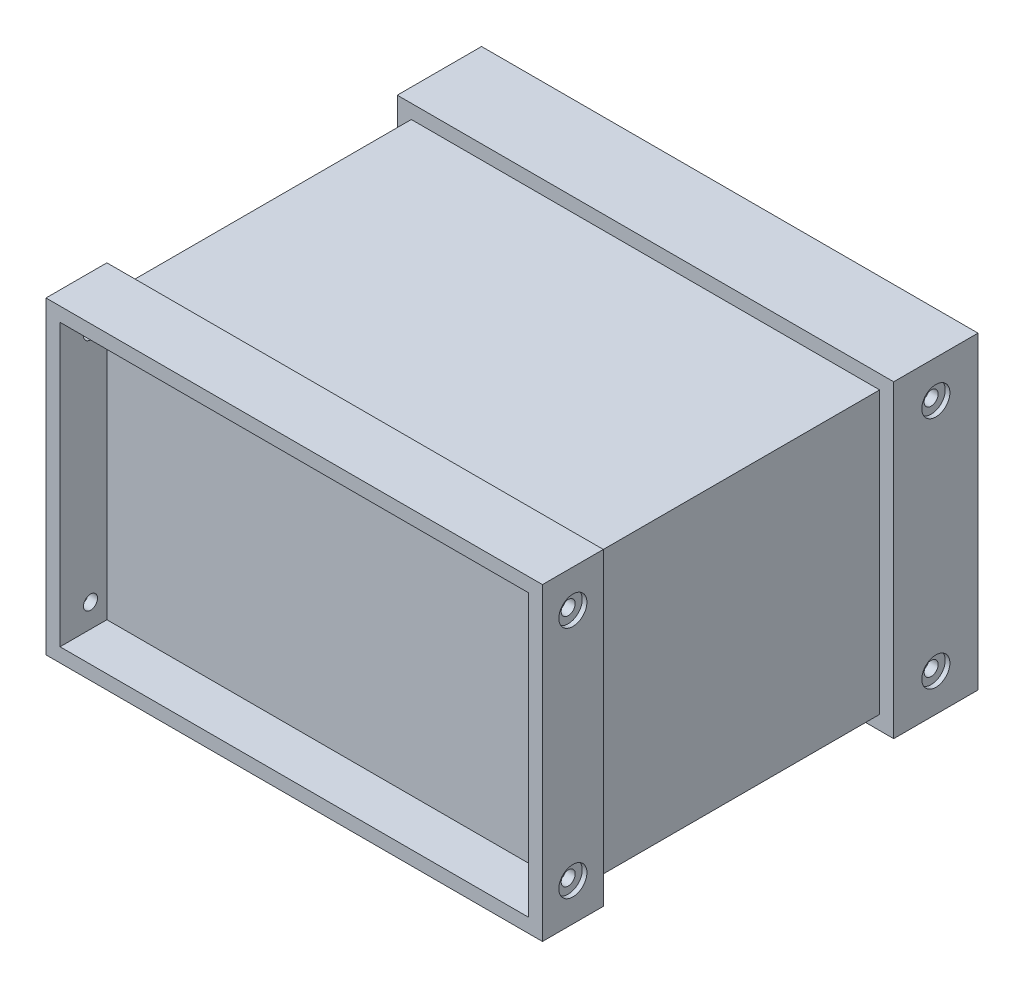
from build123d import *

# Parameters (mm, degrees)
SKETCH1_W                = 100
SKETCH1_H                = 60
BOSS_EXTRUDE1_DEPTH      = 150
SKETCH2_W                = 95
SKETCH2_H                = 15
CUT_EXTRUDE1_DEPTH       = 20
BOSS_EXTRUDE2_DEPTH      = 13
BOSS_EXTRUDE2_DEPTH_BACK = 5
SKETCH3_W                = 106
SKETCH3_H                = 66
SKETCH3_W_2              = 100
SKETCH3_H_2              = 60
SKETCH4_R                = 1.5
CUT_EXTRUDE2_DEPTH       = 120
SKETCH5_R                = 3
CUT_EXTRUDE3_DEPTH       = 1
CUT_EXTRUDE4_START       = -1
SKETCH6_R                = 3
CUT_EXTRUDE4_DEPTH       = 1
SKETCH8_W                = 125.879436885
SKETCH8_H                = 80.445742456
CUT_EXTRUDE6_DEPTH       = 80
BOSS_EXTRUDE3_DEPTH      = 10
BOSS_EXTRUDE3_DEPTH_BACK = 3
SKETCH9_W                = 106
SKETCH9_H                = 66
SKETCH9_W_2              = 100
SKETCH9_H_2              = 60
SKETCH10_R               = 1.5
CUT_EXTRUDE7_DEPTH       = 117
SKETCH10_3_R             = 3
CUT_EXTRUDE8_DEPTH       = 1
CUT_EXTRUDE9_START       = -1
SKETCH11_R               = 3
CUT_EXTRUDE9_DEPTH       = 1
SKETCH12_W               = 100
SKETCH12_H               = 60
BOSS_EXTRUDE4_DEPTH      = 2
SKETCH13_W               = 80
SKETCH13_H               = 42
CUT_EXTRUDE10_DEPTH      = 10


with BuildPart() as part:
    # Sketch1 → Boss-Extrude1 (new body)
    with BuildSketch(Plane.XY):
        with Locations((9.751655629, 0.960264901)):
            Rectangle(SKETCH1_W, SKETCH1_H)
        with BuildLine():
            Line((-37.748344371, 21.277806535), (-37.748344371, 28.460264901))
            Line((-37.748344371, 28.460264901), (-30.565886005, 28.460264901))
            ThreePointArc((-30.565886005, 28.460264901), (-33.177276559, 23.889197089), (-37.748344371, 21.277806535))
        make_face(mode=Mode.SUBTRACT)
        with BuildLine():
            Line((-37.748344371, -17.303040505), (-37.748344371, 19.223570306))
            ThreePointArc((-37.748344371, 19.223570306), (-31.763062997, 22.474983526), (-28.511649777, 28.460264901))
            Line((-28.511649777, 28.460264901), (48.014961035, 28.460264901))
            ThreePointArc((48.014961035, 28.460264901), (51.266374255, 22.474983526), (57.251655629, 19.223570306))
            Line((57.251655629, 19.223570306), (57.251655629, -17.303040505))
            ThreePointArc((57.251655629, -17.303040505), (51.266374255, -20.554453725), (48.014961035, -26.539735099))
            Line((48.014961035, -26.539735099), (-28.511649777, -26.539735099))
            ThreePointArc((-28.511649777, -26.539735099), (-31.763062997, -20.554453725), (-37.748344371, -17.303040505))
        make_face(mode=Mode.SUBTRACT)
        with BuildLine():
            Line((-37.748344371, -26.539735099), (-37.748344371, -19.357276734))
            ThreePointArc((-37.748344371, -19.357276734), (-33.177276559, -21.968667287), (-30.565886005, -26.539735099))
            Line((-30.565886005, -26.539735099), (-37.748344371, -26.539735099))
        make_face(mode=Mode.SUBTRACT)
        with BuildLine():
            Line((57.251655629, -26.539735099), (50.069197264, -26.539735099))
            ThreePointArc((50.069197264, -26.539735099), (52.680587817, -21.968667287), (57.251655629, -19.357276734))
            Line((57.251655629, -19.357276734), (57.251655629, -26.539735099))
        make_face(mode=Mode.SUBTRACT)
        with BuildLine():
            Line((57.251655629, 28.460264901), (57.251655629, 21.277806535))
            ThreePointArc((57.251655629, 21.277806535), (52.680587817, 23.889197089), (50.069197264, 28.460264901))
            Line((50.069197264, 28.460264901), (57.251655629, 28.460264901))
        make_face(mode=Mode.SUBTRACT)
    extrude(amount=BOSS_EXTRUDE1_DEPTH)

    # Sketch2 → Cut-Extrude1 (cut)
    with BuildSketch(Plane(origin=(0, 30.960264901, 0), x_dir=(1, 0, 0), z_dir=(0, 1, 0))):
        with Locations((9.751655629, -142.5)):
            Rectangle(SKETCH2_W, SKETCH2_H)
    extrude(amount=-CUT_EXTRUDE1_DEPTH, mode=Mode.SUBTRACT)

    # Sketch3 → Boss-Extrude2 (add, two sides: drawn at the far end of the back side and taken through both)
    with BuildSketch(Plane(origin=(0, 0, 0), x_dir=(-1, 0, 0), z_dir=(0, 0, -1)).offset(-BOSS_EXTRUDE2_DEPTH_BACK)):
        with Locations((-9.751655629, 0.960264901)):
            Rectangle(SKETCH3_W, SKETCH3_H)
        with Locations((-9.751655629, 0.960264901)):
            Rectangle(SKETCH3_W_2, SKETCH3_H_2, mode=Mode.SUBTRACT)
    extrude(amount=BOSS_EXTRUDE2_DEPTH + BOSS_EXTRUDE2_DEPTH_BACK)

    # Sketch4 → Cut-Extrude2 (cut)
    with BuildSketch(Plane.ZY.offset(43.248344371)):
        with Locations((-4, -24.039735099)):
            Circle(SKETCH4_R)
        with Locations((-4, 25.960264901)):
            Circle(SKETCH4_R)
    extrude(amount=-CUT_EXTRUDE2_DEPTH, mode=Mode.SUBTRACT)

    # Sketch5 → Cut-Extrude3 (cut)
    with BuildSketch(Plane(origin=(62.751655629, 0, 0), x_dir=(0, 0, -1), z_dir=(1, 0, 0))):
        with Locations((4, -24.039735099)):
            Circle(SKETCH5_R)
        with Locations((4, 25.960264901)):
            Circle(SKETCH5_R)
    extrude(amount=-CUT_EXTRUDE3_DEPTH, mode=Mode.SUBTRACT)

    # Sketch6 → Cut-Extrude4 (cut)
    with BuildSketch(Plane.ZY.offset(43.248344371).offset(CUT_EXTRUDE4_START)):
        with Locations((-4, 25.960264901)):
            Circle(SKETCH6_R)
        with Locations((-4, -24.087684502)):
            Circle(SKETCH6_R)
    extrude(amount=CUT_EXTRUDE4_DEPTH, mode=Mode.SUBTRACT)

    # Sketch8 → Cut-Extrude6 (cut)
    with BuildSketch(Plane.XY.offset(150)):
        with Locations((7.819552644, 0.433327723)):
            Rectangle(SKETCH8_W, SKETCH8_H)
    extrude(amount=-CUT_EXTRUDE6_DEPTH, mode=Mode.SUBTRACT)

    # Sketch9 → Boss-Extrude3 (add, two sides: drawn at the far end of the back side and taken through both)
    with BuildSketch(Plane.XY.offset(70).offset(-BOSS_EXTRUDE3_DEPTH_BACK)):
        with Locations((9.751655629, 0.960264901)):
            Rectangle(SKETCH9_W, SKETCH9_H)
        with Locations((9.751655629, 0.960264901)):
            Rectangle(SKETCH9_W_2, SKETCH9_H_2, mode=Mode.SUBTRACT)
    extrude(amount=BOSS_EXTRUDE3_DEPTH + BOSS_EXTRUDE3_DEPTH_BACK)

    # Sketch10 → Cut-Extrude7 (cut)
    with BuildSketch(Plane.ZY.offset(43.248344371)):
        with Locations((73.5, 25.960264901)):
            Circle(SKETCH10_R)
        with Locations((73.5, -24.039735099)):
            Circle(SKETCH10_R)
    extrude(amount=-CUT_EXTRUDE7_DEPTH, mode=Mode.SUBTRACT)

    # Sketch10<3> → Cut-Extrude8 (cut)
    with BuildSketch(Plane.ZY.offset(43.248344371)):
        with Locations((73.5, 25.960264901)):
            Circle(SKETCH10_3_R)
        with Locations((73.5, -24.039735099)):
            Circle(SKETCH10_3_R)
    extrude(amount=-CUT_EXTRUDE8_DEPTH, mode=Mode.SUBTRACT)

    # Sketch11 → Cut-Extrude9 (cut)
    with BuildSketch(Plane(origin=(62.751655629, 0, 0), x_dir=(0, 0, -1), z_dir=(1, 0, 0)).offset(CUT_EXTRUDE9_START)):
        with Locations((-73.5, -24.039735099)):
            Circle(SKETCH11_R)
        with Locations((-73.5, 25.960264901)):
            Circle(SKETCH11_R)
    extrude(amount=CUT_EXTRUDE9_DEPTH, mode=Mode.SUBTRACT)

    # Sketch12 → Boss-Extrude4 (add)
    with BuildSketch(Plane.XY.offset(70)):
        with Locations((9.751655629, 0.960264901)):
            Rectangle(SKETCH12_W, SKETCH12_H)
    extrude(amount=-BOSS_EXTRUDE4_DEPTH)

    # Sketch13 → Cut-Extrude10 (cut)
    with BuildSketch(Plane.XZ.offset(29.039735099)):
        with Locations((9.751655629, 36)):
            Rectangle(SKETCH13_W, SKETCH13_H)
    extrude(amount=-CUT_EXTRUDE10_DEPTH, mode=Mode.SUBTRACT)


solid = part.part
